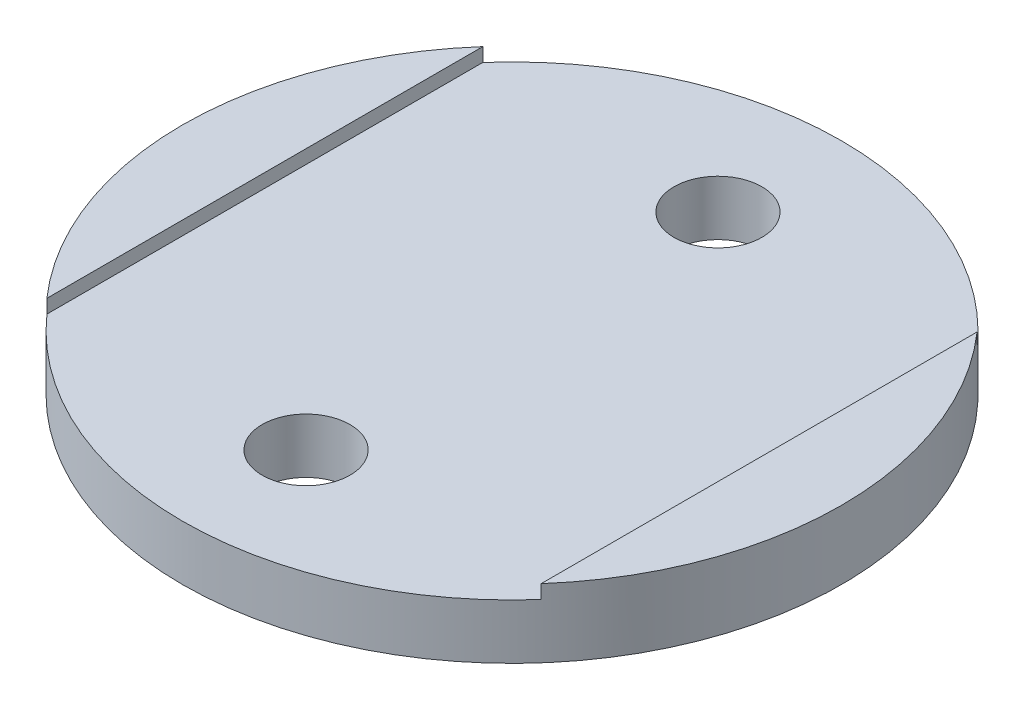
from build123d import *

# Parameters (mm, degrees)
SKETCH_1_R      = 12
SKETCH_1_R_2    = 1.6
EXTRUDE_1_DEPTH = 2
EXTRUDE_2_DEPTH = 0.5


with BuildPart() as part:
    # 草图1 → 凸台-拉伸1 (new body)
    with BuildSketch(Plane(origin=(0, 0, 0), x_dir=(1, 0, 0), z_dir=(0, 1, 0))):
        with Locations(Location((0, 0, 0), (0, 0, 270))):
            Circle(SKETCH_1_R)
        with Locations(Location((0, 7.5, 0), (0, 0, 270))):
            Circle(SKETCH_1_R_2, mode=Mode.SUBTRACT)
        with Locations(Location((0, -7.5, 0), (0, 0, 90))):
            Circle(SKETCH_1_R_2, mode=Mode.SUBTRACT)
    extrude(amount=EXTRUDE_1_DEPTH)

    # 草图2 → 凸台-拉伸2 (add)
    with BuildSketch(Plane(origin=(0, 2, 0), x_dir=(1, 0, 0), z_dir=(0, 1, 0))):
        with BuildLine():
            Line((-9, 7.937253933), (-9, -7.937253933))
            ThreePointArc((-9, -7.937253933), (-12, 0), (-9, 7.937253933))
        make_face()
    extrude_2 = extrude(amount=EXTRUDE_2_DEPTH)

    # 镜向2: 凸台-拉伸2 across plane
    add(extrude_2.mirror(Plane(origin=(0, 0, 0), x_dir=(0, 0, 1), z_dir=(1, 0, 0))))


solid = part.part
